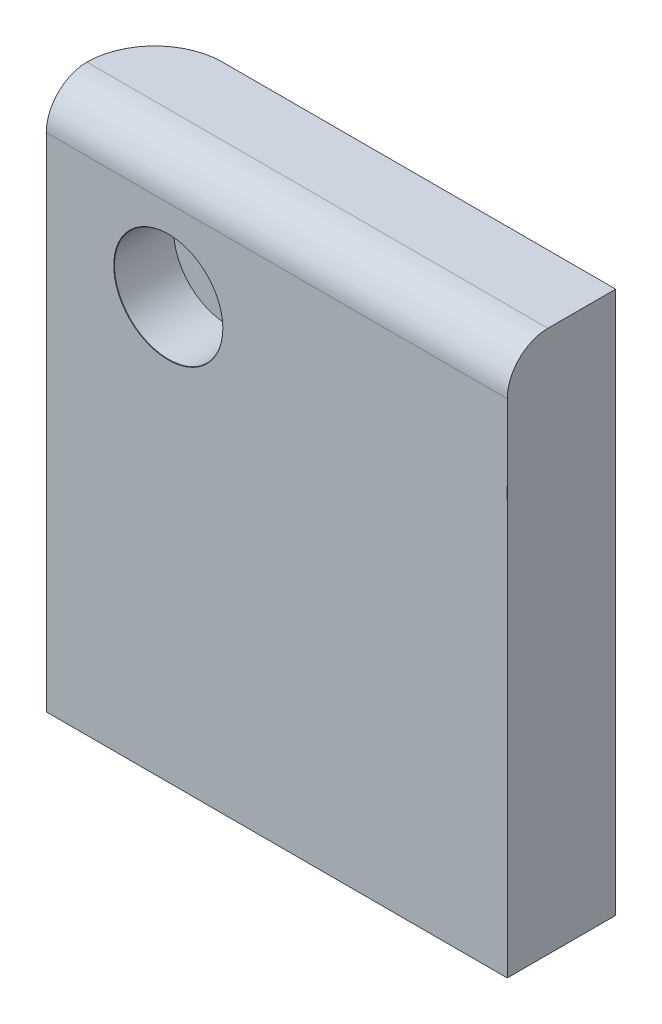
from build123d import *

# Parameters (mm, degrees)
SKETCH1_W                                    = 47
SKETCH1_H                                    = 8
BOSS_EXTRUDE1_DEPTH                          = 40
FILLET1_R                                    = 3
FILLET2_R                                    = 5
CBORE_FOR_M4_HEX_SOCKET_HEAD_CAP_SCR_2_COUNT = 2
CBORE_FOR_M4_HEX_SOCKET_HEAD_CAP_SCR_2_PITCH = 29
CUT_EXTRUDE1_REACH                           = 49.077
SKETCH5_W                                    = 13
SKETCH5_H                                    = 44.997787144


with BuildPart() as part:
    # Sketch1 → Boss-Extrude1 (new body)
    with BuildSketch(Plane(origin=(0, 0, 0), x_dir=(1, 0, 0), z_dir=(0, 1, 0))):
        Rectangle(SKETCH1_W, SKETCH1_H)
    extrude(amount=-BOSS_EXTRUDE1_DEPTH)

    # Fillet1
    fillet1_edges = [part.edges().sort_by_distance(p)[0] for p in [
        (0, 0, 4),
    ]]
    fillet(fillet1_edges, radius=FILLET1_R)

    # Fillet2
    fillet2_edges = [part.edges().sort_by_distance(p)[0] for p in [
        (-23.5, -20, -4),
        (23.5, -20, -4),
    ]]
    fillet(fillet2_edges, radius=FILLET2_R)

    # Sketch3 → CBORE for M4 Hex Socket Head Cap Screw1 (revolve, cut)
    with BuildSketch(Plane(origin=(-14.5, -9, 4), x_dir=(0, -1, 0), z_dir=(1, 0, 0))):
        Polygon((0, 0), (0, 8), (2.15, 8), (2.15, 4.4), (4, 4.4), (4, 0.025), (4.025, 0), align=None)
    cbore_for_m4_hex_socket_head_cap_screw1 = revolve(axis=Axis((-14.5, -9, 10.35), (0, 0, -1)), mode=Mode.SUBTRACT)

    # CBORE for M4 Hex Socket Head Cap Scr 2: CBORE for M4 Hex Socket Head Cap Screw1 ×2
    with Locations(*[(i * CBORE_FOR_M4_HEX_SOCKET_HEAD_CAP_SCR_2_PITCH, 0, 0) for i in range(1, CBORE_FOR_M4_HEX_SOCKET_HEAD_CAP_SCR_2_COUNT)]):
        add(cbore_for_m4_hex_socket_head_cap_screw1, mode=Mode.SUBTRACT)

    # Sketch5 → Cut-Extrude1 (cut, up to next)
    with BuildSketch(Plane.XY.offset(4), mode=Mode.PRIVATE) as cut_extrude1_sk1:
        with Locations((17, -17.501106428)):
            Rectangle(SKETCH5_W, SKETCH5_H)
    cut_extrude1_tool1 = extrude(cut_extrude1_sk1.sketch, amount=-CUT_EXTRUDE1_REACH, mode=Mode.PRIVATE) & part.part
    add(cut_extrude1_tool1.solids().sort_by_distance((17, -17.501106, 4))[0], mode=Mode.SUBTRACT)


solid = part.part
